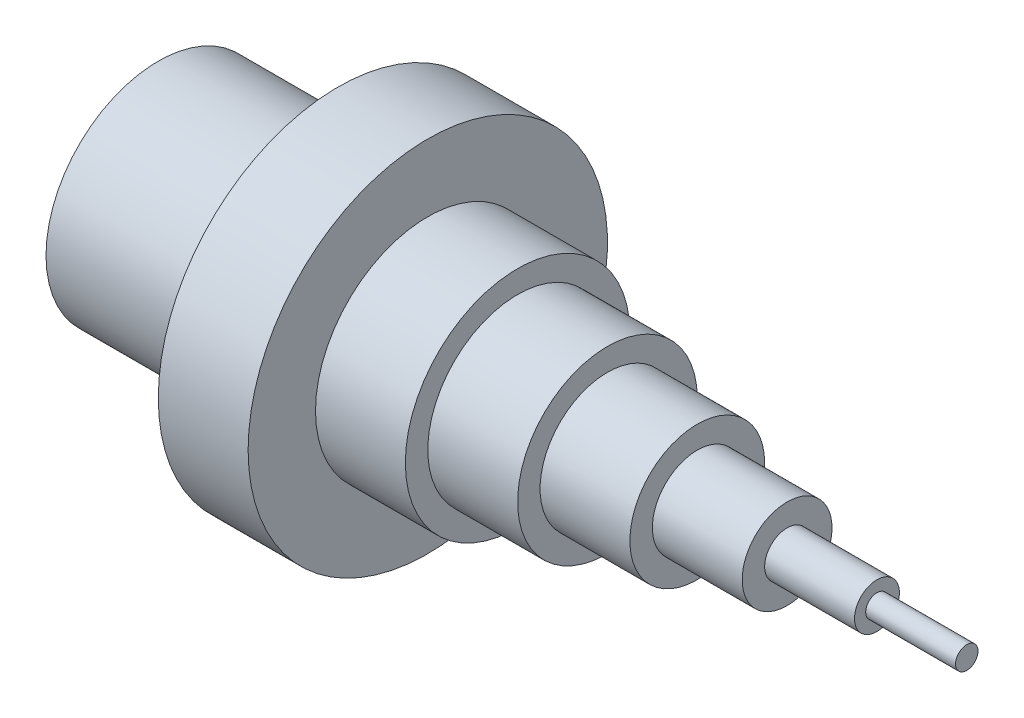
from build123d import *

# Parameters (mm, degrees)
SKETCH_1_R      = 25
EXTRUDE_1_DEPTH = 20
SKETCH_2_R      = 20
EXTRUDE_2_DEPTH = 20
SKETCH_3_R      = 15
EXTRUDE_3_DEPTH = 20
SKETCH_4_R      = 10
EXTRUDE_4_DEPTH = 20
SKETCH_5_R      = 5
EXTRUDE_5_DEPTH = 20
SKETCH_6_R      = 2.5
EXTRUDE_6_DEPTH = 20
SKETCH_7_R      = 40
EXTRUDE_7_DEPTH = 20
EXTRUDE_START   = 40
SKETCH_8_R      = 25
EXTRUDE_8_DEPTH = 40
SKETCH_9_R      = 20
EXTRUDE_9_DEPTH = 40


with BuildPart() as part:
    # 草圖1 → 擠出1 (new body)
    with BuildSketch(Plane.YZ):
        with Locations(Location((0, 0, 0), (0, 0, 270))):
            Circle(SKETCH_1_R)
    extrude(amount=EXTRUDE_1_DEPTH)

    # 草圖2 → 擠出2 (add)
    with BuildSketch(Plane(origin=(20, 0, 0), x_dir=(0, 0, -1), z_dir=(1, 0, 0))):
        Circle(SKETCH_2_R)
    extrude(amount=EXTRUDE_2_DEPTH)

    # 草圖3 → 擠出3 (add)
    with BuildSketch(Plane(origin=(40, 0, 0), x_dir=(0, 0, -1), z_dir=(1, 0, 0))):
        Circle(SKETCH_3_R)
    extrude(amount=EXTRUDE_3_DEPTH)

    # 草圖4 → 擠出4 (add)
    with BuildSketch(Plane(origin=(60, 0, 0), x_dir=(0, 0, -1), z_dir=(1, 0, 0))):
        Circle(SKETCH_4_R)
    extrude(amount=EXTRUDE_4_DEPTH)

    # 草圖5 → 擠出5 (add)
    with BuildSketch(Plane(origin=(80, 0, 0), x_dir=(0, 0, -1), z_dir=(1, 0, 0))):
        Circle(SKETCH_5_R)
    extrude(amount=EXTRUDE_5_DEPTH)

    # 草圖6 → 擠出6 (add)
    with BuildSketch(Plane(origin=(100, 0, 0), x_dir=(0, 0, -1), z_dir=(1, 0, 0))):
        Circle(SKETCH_6_R)
    extrude(amount=EXTRUDE_6_DEPTH)

    # 草圖7 → 擠出7 (add)
    with BuildSketch(Plane.ZY):
        Circle(SKETCH_7_R)
    extrude(amount=EXTRUDE_7_DEPTH)

    # 草圖8 → 擠出8 (add)
    with BuildSketch(Plane.ZY.offset(20).offset(EXTRUDE_START)):
        with Locations(Location((0, 0, 0), (0, 0, 180))):
            Circle(SKETCH_8_R)
    extrude(amount=-EXTRUDE_8_DEPTH)

    # 草圖9 → 擠出9 (cut)
    with BuildSketch(Plane.ZY.offset(60)):
        with Locations(Location((0, 0, 0), (0, 0, 180))):
            Circle(SKETCH_9_R)
    extrude(amount=-EXTRUDE_9_DEPTH, mode=Mode.SUBTRACT)


solid = part.part
